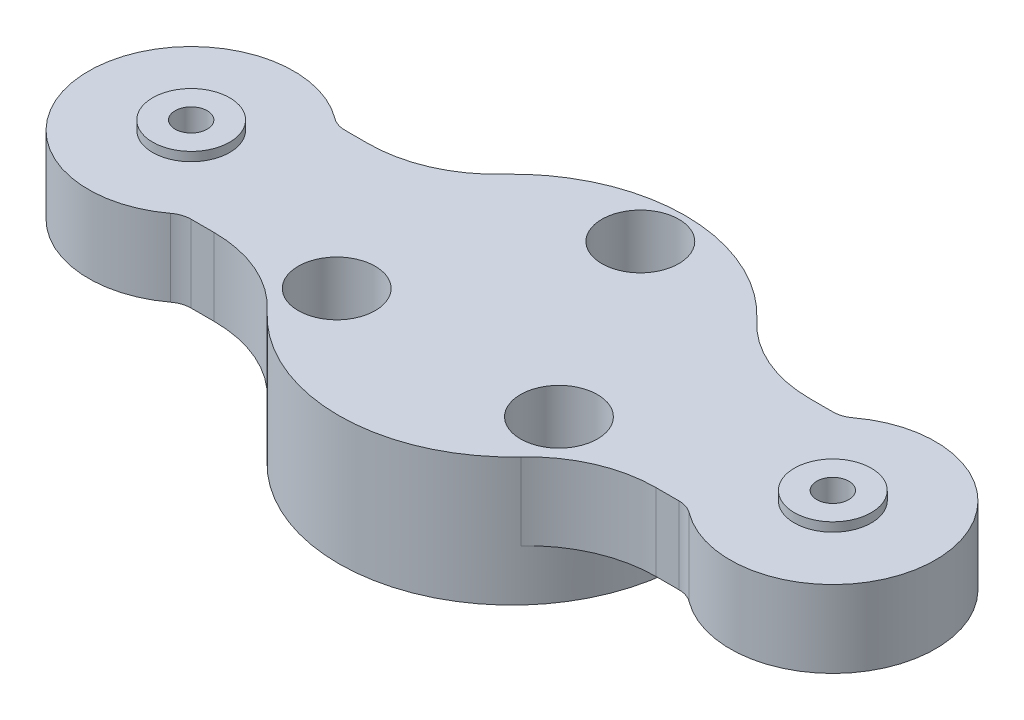
from build123d import *

# Parameters (mm, degrees)
SKETCH_1_R          = 13.5
SKETCH_1_R_2        = 1.6
EXTRUDE_1_DEPTH     = 10
EXTRUDE_START       = -6
SKETCH_2_R          = 1
EXTRUDE_2_DEPTH     = 6
SKETCH_3_R          = 3
CUT_EXTRUDE_1_DEPTH = 5
SKETCH_4_R          = 3
SKETCH_4_R_2        = 1
EXTRUDE_3_DEPTH     = 0.7
FILLET_1_R          = 10
FILLET_2_R          = 2
HOLE_WIZARD_M3_1_D  = 2.5
F_2_0MM_2_D         = 2
F_2_0MM_2_DEPTH     = 6
F_2_0MM_2_TIP       = 0.600860619


with BuildPart() as part:
    # 草图1 → 凸台-拉伸1 (new body)
    with BuildSketch(Plane(origin=(0, 0, 0), x_dir=(1, 0, 0), z_dir=(0, 1, 0))):
        with Locations(Location((0, 0, 0), (0, 0, 270))):
            Circle(SKETCH_1_R)
        with Locations(Location((0, 10, 0), (0, 0, 270))):
            Circle(SKETCH_1_R_2, mode=Mode.SUBTRACT)
        with Locations(Location((8.660254038, -5, 0), (0, 0, 270))):
            Circle(SKETCH_1_R_2, mode=Mode.SUBTRACT)
        with Locations(Location((-8.660254038, -5, 0), (0, 0, 270))):
            Circle(SKETCH_1_R_2, mode=Mode.SUBTRACT)
    extrude(amount=EXTRUDE_1_DEPTH)

    # 草图2 → 凸台-拉伸2 (add)
    # profile 1 of 2: a face of its own
    with BuildSketch(Plane(origin=(0, 10, 0), x_dir=(1, 0, 0), z_dir=(0, 1, 0)).offset(EXTRUDE_START)):
        with BuildLine():
            Line((-12.093386622, 6), (-19.708497378, 6))
            ThreePointArc((-19.708497378, 6), (-33, 0), (-19.708497378, -6))
            Line((-19.708497378, -6), (-12.093386622, -6))
            ThreePointArc((-12.093386622, -6), (-13.5, 0), (-12.093386622, 6))
        make_face()
        with Locations(Location((-25, 0, 0), (0, 0, 270))):
            Circle(SKETCH_2_R, mode=Mode.SUBTRACT)
    # profile 2 of 2: a face of its own
    with BuildSketch(Plane(origin=(0, 10, 0), x_dir=(1, 0, 0), z_dir=(0, 1, 0)).offset(EXTRUDE_START)):
        with BuildLine():
            ThreePointArc((13.5, 0), (13.143643319, -3.08133742), (12.093386622, -6))
            Line((12.093386622, -6), (19.708497378, -6))
            ThreePointArc((19.708497378, -6), (33, 0), (19.708497378, 6))
            Line((19.708497378, 6), (12.093386622, 6))
            ThreePointArc((12.093386622, 6), (13.143643319, 3.08133742), (13.5, 0))
        make_face()
        with Locations(Location((25, 0, 0), (0, 0, 270))):
            Circle(SKETCH_2_R, mode=Mode.SUBTRACT)
    extrude(amount=EXTRUDE_2_DEPTH)

    # 草图3 → 切除-拉伸1 (cut)
    with BuildSketch(Plane(origin=(0, 10, 0), x_dir=(1, 0, 0), z_dir=(0, 1, 0))):
        with Locations(Location((0, 10, 0), (0, 0, 270))):
            Circle(SKETCH_3_R)
        with Locations(Location((8.660254038, -5, 0), (0, 0, 270))):
            Circle(SKETCH_3_R)
        with Locations(Location((-8.660254038, -5, 0), (0, 0, 270))):
            Circle(SKETCH_3_R)
    extrude(amount=-CUT_EXTRUDE_1_DEPTH, mode=Mode.SUBTRACT)

    # 草图4 → 凸台-拉伸3 (add)
    # profile 1 of 2: a face of its own
    with BuildSketch(Plane(origin=(0, 10, 0), x_dir=(1, 0, 0), z_dir=(0, 1, 0))):
        with Locations(Location((-25, 0, 0), (0, 0, 270))):
            Circle(SKETCH_4_R)
        with Locations(Location((-25, 0, 0), (0, 0, 270))):
            Circle(SKETCH_4_R_2, mode=Mode.SUBTRACT)
    # profile 2 of 2: a face of its own
    with BuildSketch(Plane(origin=(0, 10, 0), x_dir=(1, 0, 0), z_dir=(0, 1, 0))):
        with Locations(Location((25, 0, 0), (0, 0, 270))):
            Circle(SKETCH_4_R)
        with Locations(Location((25, 0, 0), (0, 0, 270))):
            Circle(SKETCH_4_R_2, mode=Mode.SUBTRACT)
    extrude(amount=EXTRUDE_3_DEPTH)

    # 圆角1
    fillet_1_edges = [part.edges().sort_by_distance(p)[0] for p in [
        (-12.093386622, 7, -6),
        (-12.093386622, 7, 6),
        (12.093386622, 7, 6),
        (12.093386622, 7, -6),
    ]]
    fillet(fillet_1_edges, radius=FILLET_1_R)

    # 圆角2
    fillet_2_edges = [part.edges().sort_by_distance(p)[0] for p in [
        (-19.708497378, 7, -6),
        (-19.708497378, 7, 6),
        (19.708497378, 7, -6),
        (19.708497378, 7, 6),
    ]]
    fillet(fillet_2_edges, radius=FILLET_2_R)

    # M3 螺纹孔1 (through all)
    with Locations(Plane(origin=(0, 10.7, 0), x_dir=(1, 0, 0), z_dir=(0, 1, 0))):
        with Locations((-25, 0), (25, 0)):
            Hole(HOLE_WIZARD_M3_1_D / 2)

    # Ø2.0mm 暗销孔2
    with Locations(Plane.XZ):
        with Locations((-8.660254038, -5), (0, 10), (8.660254038, -5)):
            Hole(F_2_0MM_2_D / 2, depth=F_2_0MM_2_DEPTH)
            with Locations((0, 0, -(F_2_0MM_2_DEPTH + F_2_0MM_2_TIP / 2))):  # 118° drill point
                Cone(0, F_2_0MM_2_D / 2, F_2_0MM_2_TIP, mode=Mode.SUBTRACT)


solid = part.part
